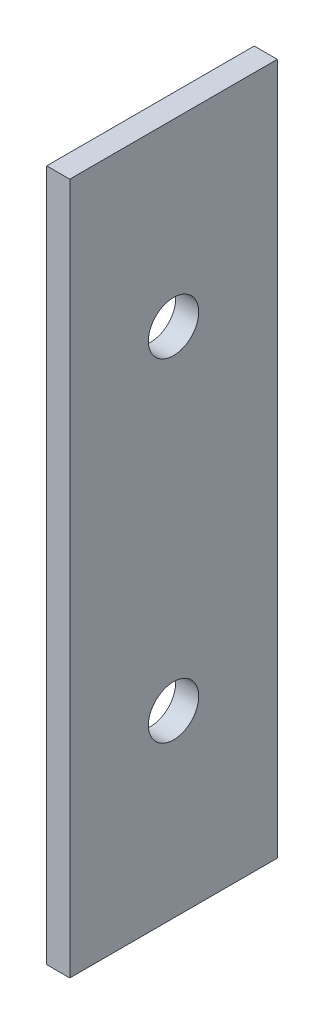
from build123d import *

# Parameters (mm, degrees)
BOSS_EXTRUDE1_DEPTH = 9
SKETCH2_R           = 1.0922
CUT_EXTRUDE1_DEPTH  = 10


with BuildPart() as part:
    # Sketch1 → Boss-Extrude1 (new body)
    with BuildSketch(Plane.XY):
        Polygon((3.129243729, 7.05753004), (2.129243729, 7.05753004), (2.129243729, -22.94246996), (3.129243729, -22.94246996), (3.129243729, -4.94246996), align=None)
    extrude(amount=BOSS_EXTRUDE1_DEPTH)

    # Sketch2 → Cut-Extrude1 (cut)
    with BuildSketch(Plane(origin=(3.129243729, 0, 0), x_dir=(0, 0, -1), z_dir=(1, 0, 0))):
        with Locations(Location((-4.5, -0.72746996, 0), (0, 0, 90))):
            Circle(SKETCH2_R)
        with Locations(Location((-4.5, -15.15746996, 0), (0, 0, 90))):
            Circle(SKETCH2_R)
    extrude(amount=-CUT_EXTRUDE1_DEPTH, mode=Mode.SUBTRACT)


solid = part.part
